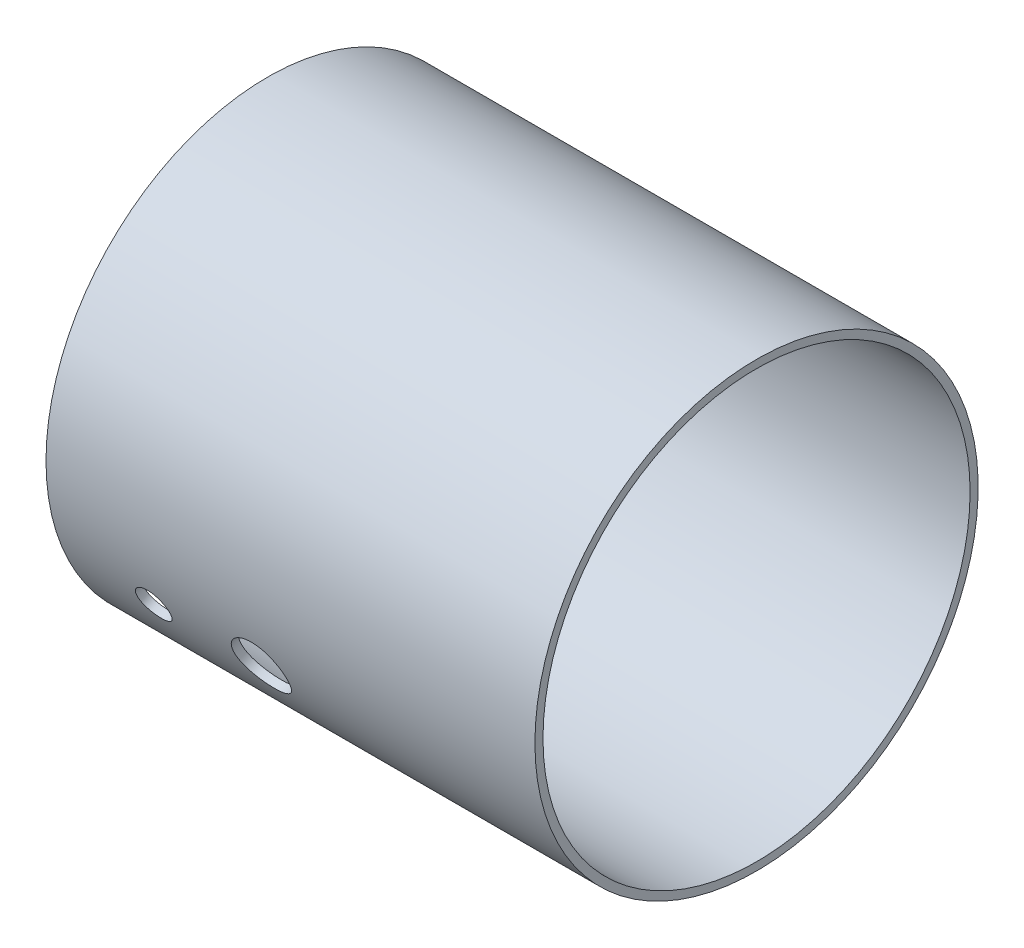
from build123d import *

# Parameters (mm, degrees)
SKETCH1_W               = 182
SKETCH1_H               = 3
CUT_EXTRUDE1_REACH      = 181.132
CUT_EXTRUDE1_END_RADIUS = 82.5
SKETCH2_R               = 10.4
SKETCH2_R_2             = 6.35


with BuildPart() as part:
    # Sketch1 → Revolve1 (revolve)
    with BuildSketch(Plane.XY, mode=Mode.PRIVATE) as revolve1_sk:
        with Locations((91, 81)):
            Rectangle(SKETCH1_W, SKETCH1_H)
    revolve(revolve1_sk.sketch.rotate(Axis((-120.017932179, 0, 0), (1, 0, 0)), 90), axis=Axis((-120.017932179, 0, 0), (1, 0, 0)))

    # Cut-Extrude1: up to this cylinder (the profile starts inside it)
    cut_extrude1_end = Plane(origin=(53, 0, 0), z_dir=(-1, 0, 0)) * Cylinder(CUT_EXTRUDE1_END_RADIUS, 568.264, mode=Mode.PRIVATE)
    # Sketch2 → Cut-Extrude1 (cut, up to the surface)
    with BuildSketch(Plane(origin=(91.819980732, -35.746260181, -15.862931908), x_dir=(1, 0, 0), z_dir=(1.974262242059059e-15, -0.4056196449704911, 0.9140419594384127)), mode=Mode.PRIVATE) as cut_extrude1_sk1:
        with Locations(Location((-18.819980732, 39.107898508, 0), (0, 0, 90))):
            Circle(SKETCH2_R)
    cut_extrude1_tool1 = extrude(cut_extrude1_sk1.sketch, amount=CUT_EXTRUDE1_REACH, mode=Mode.PRIVATE) & cut_extrude1_end
    add(cut_extrude1_tool1.solids().sort_by_distance((73, 0, 0))[0], mode=Mode.SUBTRACT)
    # Sketch2 → Cut-Extrude1 (cut, up to the surface)
    with BuildSketch(Plane(origin=(91.819980732, -35.746260181, -15.862931908), x_dir=(1, 0, 0), z_dir=(1.974262242059059e-15, -0.4056196449704911, 0.9140419594384127)), mode=Mode.PRIVATE) as cut_extrude1_sk2:
        with Locations(Location((-58.819980732, 39.107898508, 0), (0, 0, 90))):
            Circle(SKETCH2_R_2)
    cut_extrude1_tool2 = extrude(cut_extrude1_sk2.sketch, amount=CUT_EXTRUDE1_REACH, mode=Mode.PRIVATE) & cut_extrude1_end
    add(cut_extrude1_tool2.solids().sort_by_distance((33, 0, 0))[0], mode=Mode.SUBTRACT)


solid = part.part
